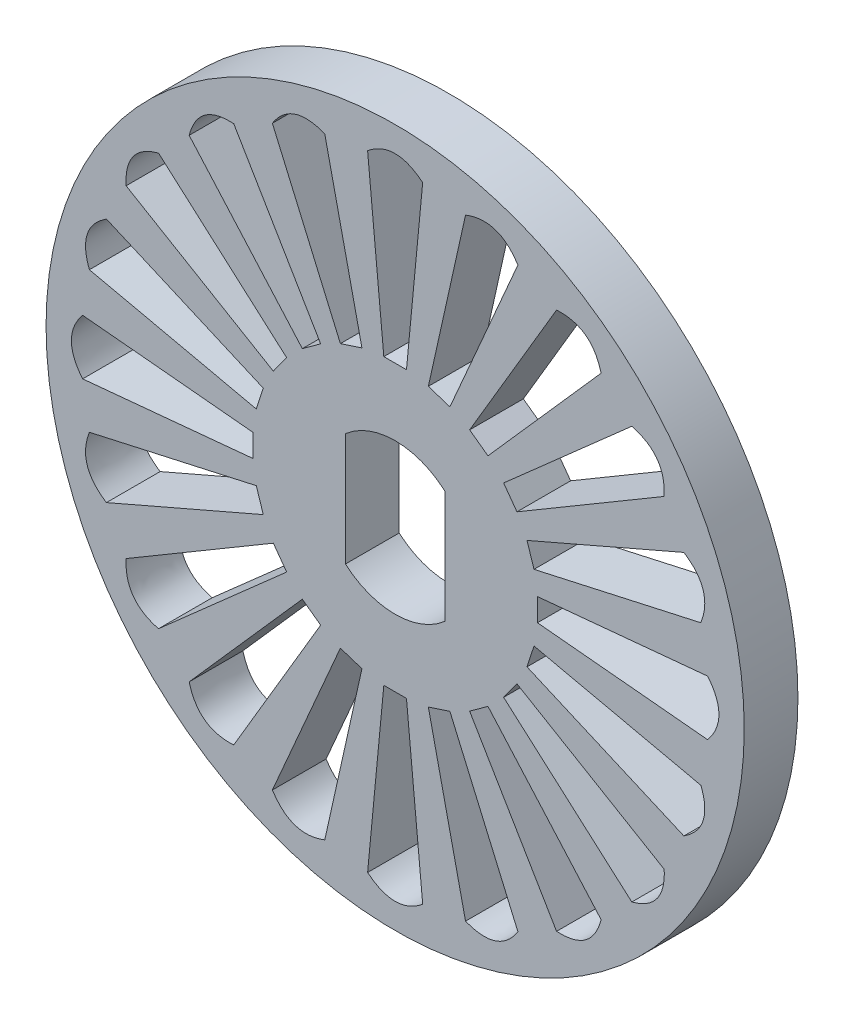
from build123d import *

# Parameters (mm, degrees)
SKETCH1_R           = 13
BOSS_EXTRUDE1_DEPTH = 2
CUT_EXTRUDE1_DEPTH  = 2
CUT_EXTRUDE2_DEPTH  = 2


with BuildPart() as part:
    # Sketch1 → Boss-Extrude1 (new body)
    with BuildSketch(Plane.XY):
        Circle(SKETCH1_R)
    extrude(amount=BOSS_EXTRUDE1_DEPTH)

    # Sketch2 → Cut-Extrude1 (cut)
    with BuildSketch(Plane.XY.offset(2)):
        with BuildLine():
            Line((1.85, 2.101784956), (1.85, -2.101784956))
            ThreePointArc((1.85, -2.101784956), (0, -2.8), (-1.85, -2.101784956))
            Line((-1.85, -2.101784956), (-1.85, 2.101784956))
            ThreePointArc((-1.85, 2.101784956), (0, 2.8), (1.85, 2.101784956))
        make_face()
    extrude(amount=-CUT_EXTRUDE1_DEPTH, mode=Mode.SUBTRACT)

    # Sketch3 → Cut-Extrude2 (cut)
    with BuildSketch(Plane.XY.offset(2)):
        with BuildLine():
            Line((-0.421898485, 5.3), (0.421898485, 5.3))
            Line((0.421898485, 5.3), (1.025755042, 11.638206547))
            add(Edge.make_bspline(
                [(-1.025755042, 11.638206547), (0, 12.476130474), (1.025755042, 11.638206547)],
                knots=[0, 0, 0, 1, 1, 1], degree=2))
            Line((-1.025755042, 11.638206547), (-0.421898485, 5.3))
        make_face()
        with BuildLine():
            Line((2.039039374, 4.910225735), (4.571954624, 10.751616435))
            add(Edge.make_bspline(
                [(2.62085259, 11.385567915), (3.85533634, 11.865505185), (4.571954624, 10.751616435)],
                knots=[0, 0, 0, 1, 1, 1], degree=2))
            Line((2.62085259, 11.385567915), (1.236540767, 5.170973338))
            Line((1.236540767, 5.170973338), (2.039039374, 4.910225735))
        make_face()
        with BuildLine():
            Line((3.456584881, 4.039804363), (7.670619433, 8.812583195))
            add(Edge.make_bspline(
                [(6.01091291, 10.018430567), (7.333285498, 10.093401577), (7.670619433, 8.812583195)],
                knots=[0, 0, 0, 1, 1, 1], degree=2))
            Line((6.01091291, 10.018430567), (2.773938793, 4.535775778))
            Line((2.773938793, 4.535775778), (3.456584881, 4.039804363))
        make_face()
        with BuildLine():
            Line((4.535775778, 2.773938793), (10.018430567, 6.01091291))
            add(Edge.make_bspline(
                [(8.812583195, 7.670619433), (10.093401577, 7.333285498), (10.018430567, 6.01091291)],
                knots=[0, 0, 0, 1, 1, 1], degree=2))
            Line((8.812583195, 7.670619433), (4.039804363, 3.456584881))
            Line((4.039804363, 3.456584881), (4.535775778, 2.773938793))
        make_face()
        with BuildLine():
            Line((5.170973338, 1.236540767), (11.385567915, 2.62085259))
            add(Edge.make_bspline(
                [(10.751616435, 4.571954624), (11.865505185, 3.85533634), (11.385567915, 2.62085259)],
                knots=[0, 0, 0, 1, 1, 1], degree=2))
            Line((10.751616435, 4.571954624), (4.910225735, 2.039039374))
            Line((4.910225735, 2.039039374), (5.170973338, 1.236540767))
        make_face()
        with BuildLine():
            Line((5.3, -0.421898485), (11.638206547, -1.025755042))
            add(Edge.make_bspline(
                [(11.638206547, 1.025755042), (12.476130474, 0), (11.638206547, -1.025755042)],
                knots=[0, 0, 0, 1, 1, 1], degree=2))
            Line((11.638206547, 1.025755042), (5.3, 0.421898485))
            Line((5.3, 0.421898485), (5.3, -0.421898485))
        make_face()
        with BuildLine():
            Line((4.910225735, -2.039039374), (10.751616435, -4.571954624))
            add(Edge.make_bspline(
                [(11.385567915, -2.62085259), (11.865505185, -3.85533634), (10.751616435, -4.571954624)],
                knots=[0, 0, 0, 1, 1, 1], degree=2))
            Line((11.385567915, -2.62085259), (5.170973338, -1.236540767))
            Line((5.170973338, -1.236540767), (4.910225735, -2.039039374))
        make_face()
        with BuildLine():
            Line((4.039804363, -3.456584881), (8.812583195, -7.670619433))
            add(Edge.make_bspline(
                [(10.018430567, -6.01091291), (10.093401577, -7.333285498), (8.812583195, -7.670619433)],
                knots=[0, 0, 0, 1, 1, 1], degree=2))
            Line((10.018430567, -6.01091291), (4.535775778, -2.773938793))
            Line((4.535775778, -2.773938793), (4.039804363, -3.456584881))
        make_face()
        with BuildLine():
            Line((2.773938793, -4.535775778), (6.01091291, -10.018430567))
            add(Edge.make_bspline(
                [(7.670619433, -8.812583195), (7.333285498, -10.093401577), (6.01091291, -10.018430567)],
                knots=[0, 0, 0, 1, 1, 1], degree=2))
            Line((7.670619433, -8.812583195), (3.456584881, -4.039804363))
            Line((3.456584881, -4.039804363), (2.773938793, -4.535775778))
        make_face()
        with BuildLine():
            Line((1.236540767, -5.170973338), (2.62085259, -11.385567915))
            add(Edge.make_bspline(
                [(4.571954624, -10.751616435), (3.85533634, -11.865505185), (2.62085259, -11.385567915)],
                knots=[0, 0, 0, 1, 1, 1], degree=2))
            Line((4.571954624, -10.751616435), (2.039039374, -4.910225735))
            Line((2.039039374, -4.910225735), (1.236540767, -5.170973338))
        make_face()
        with BuildLine():
            Line((-0.421898485, -5.3), (-1.025755042, -11.638206547))
            add(Edge.make_bspline(
                [(1.025755042, -11.638206547), (0, -12.476130474), (-1.025755042, -11.638206547)],
                knots=[0, 0, 0, 1, 1, 1], degree=2))
            Line((1.025755042, -11.638206547), (0.421898485, -5.3))
            Line((0.421898485, -5.3), (-0.421898485, -5.3))
        make_face()
        with BuildLine():
            Line((-2.039039374, -4.910225735), (-4.571954624, -10.751616435))
            add(Edge.make_bspline(
                [(-2.62085259, -11.385567915), (-3.85533634, -11.865505185), (-4.571954624, -10.751616435)],
                knots=[0, 0, 0, 1, 1, 1], degree=2))
            Line((-2.62085259, -11.385567915), (-1.236540767, -5.170973338))
            Line((-1.236540767, -5.170973338), (-2.039039374, -4.910225735))
        make_face()
        with BuildLine():
            Line((-3.456584881, -4.039804363), (-7.670619433, -8.812583195))
            add(Edge.make_bspline(
                [(-6.01091291, -10.018430567), (-7.333285498, -10.093401577), (-7.670619433, -8.812583195)],
                knots=[0, 0, 0, 1, 1, 1], degree=2))
            Line((-6.01091291, -10.018430567), (-2.773938793, -4.535775778))
            Line((-2.773938793, -4.535775778), (-3.456584881, -4.039804363))
        make_face()
        with BuildLine():
            Line((-4.535775778, -2.773938793), (-10.018430567, -6.01091291))
            add(Edge.make_bspline(
                [(-8.812583195, -7.670619433), (-10.093401577, -7.333285498), (-10.018430567, -6.01091291)],
                knots=[0, 0, 0, 1, 1, 1], degree=2))
            Line((-8.812583195, -7.670619433), (-4.039804363, -3.456584881))
            Line((-4.039804363, -3.456584881), (-4.535775778, -2.773938793))
        make_face()
        with BuildLine():
            Line((-5.170973338, -1.236540767), (-11.385567915, -2.62085259))
            add(Edge.make_bspline(
                [(-10.751616435, -4.571954624), (-11.865505185, -3.85533634), (-11.385567915, -2.62085259)],
                knots=[0, 0, 0, 1, 1, 1], degree=2))
            Line((-10.751616435, -4.571954624), (-4.910225735, -2.039039374))
            Line((-4.910225735, -2.039039374), (-5.170973338, -1.236540767))
        make_face()
        with BuildLine():
            Line((-5.3, 0.421898485), (-11.638206547, 1.025755042))
            add(Edge.make_bspline(
                [(-11.638206547, -1.025755042), (-12.476130474, 0), (-11.638206547, 1.025755042)],
                knots=[0, 0, 0, 1, 1, 1], degree=2))
            Line((-11.638206547, -1.025755042), (-5.3, -0.421898485))
            Line((-5.3, -0.421898485), (-5.3, 0.421898485))
        make_face()
        with BuildLine():
            Line((-4.910225735, 2.039039374), (-10.751616435, 4.571954624))
            add(Edge.make_bspline(
                [(-11.385567915, 2.62085259), (-11.865505185, 3.85533634), (-10.751616435, 4.571954624)],
                knots=[0, 0, 0, 1, 1, 1], degree=2))
            Line((-11.385567915, 2.62085259), (-5.170973338, 1.236540767))
            Line((-5.170973338, 1.236540767), (-4.910225735, 2.039039374))
        make_face()
        with BuildLine():
            Line((-4.039804363, 3.456584881), (-8.812583195, 7.670619433))
            add(Edge.make_bspline(
                [(-10.018430567, 6.01091291), (-10.093401577, 7.333285498), (-8.812583195, 7.670619433)],
                knots=[0, 0, 0, 1, 1, 1], degree=2))
            Line((-10.018430567, 6.01091291), (-4.535775778, 2.773938793))
            Line((-4.535775778, 2.773938793), (-4.039804363, 3.456584881))
        make_face()
        with BuildLine():
            Line((-2.773938793, 4.535775778), (-6.01091291, 10.018430567))
            add(Edge.make_bspline(
                [(-7.670619433, 8.812583195), (-7.333285498, 10.093401577), (-6.01091291, 10.018430567)],
                knots=[0, 0, 0, 1, 1, 1], degree=2))
            Line((-7.670619433, 8.812583195), (-3.456584881, 4.039804363))
            Line((-3.456584881, 4.039804363), (-2.773938793, 4.535775778))
        make_face()
        with BuildLine():
            Line((-1.236540767, 5.170973338), (-2.62085259, 11.385567915))
            add(Edge.make_bspline(
                [(-4.571954624, 10.751616435), (-3.85533634, 11.865505185), (-2.62085259, 11.385567915)],
                knots=[0, 0, 0, 1, 1, 1], degree=2))
            Line((-4.571954624, 10.751616435), (-2.039039374, 4.910225735))
            Line((-2.039039374, 4.910225735), (-1.236540767, 5.170973338))
        make_face()
    extrude(amount=-CUT_EXTRUDE2_DEPTH, mode=Mode.SUBTRACT)


solid = part.part
